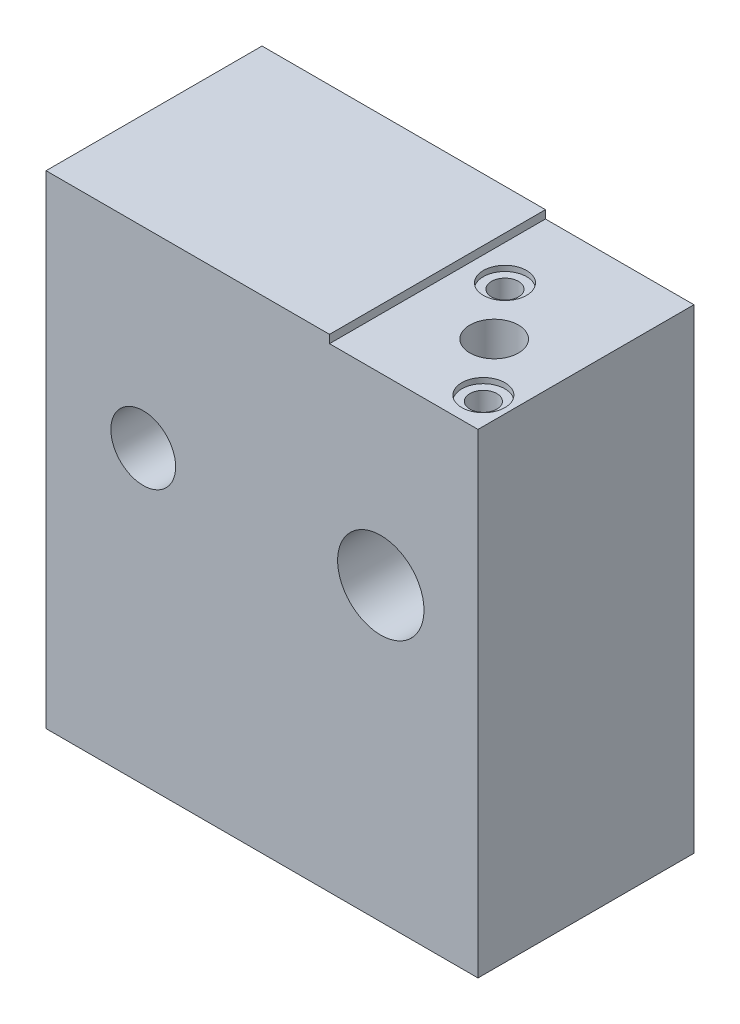
from build123d import *

# Parameters (mm, degrees)
SKETCH_1_W          = 80
SKETCH_1_H          = 40
EXTRUDE_1_DEPTH     = 89.5
SKETCH_2_W          = 27.5
SKETCH_2_H          = 1.5
CUT_EXTRUDE_1_DEPTH = 46
SKETCH_3_R          = 6
SKETCH_3_R_2        = 8
CUT_EXTRUDE_2_DEPTH = 46
SKETCH_4_R          = 2.5
SKETCH_4_R_2        = 4.5
CUT_EXTRUDE_3_DEPTH = 15
SKETCH_5_R          = 4
CUT_EXTRUDE_4_DEPTH = 1


with BuildPart() as part:
    # 草图1 → 凸台-拉伸1 (new body)
    with BuildSketch(Plane(origin=(0, 0, 0), x_dir=(1, 0, 0), z_dir=(0, 1, 0))):
        Rectangle(SKETCH_1_W, SKETCH_1_H)
    extrude(amount=EXTRUDE_1_DEPTH)

    # 草图2 → 切除-拉伸1 (cut)
    with BuildSketch(Plane.XY.offset(20)):
        with Locations((26.25, 88.75)):
            Rectangle(SKETCH_2_W, SKETCH_2_H)
    extrude(amount=-CUT_EXTRUDE_1_DEPTH, mode=Mode.SUBTRACT)

    # 草图3 → 切除-拉伸2 (cut)
    with BuildSketch(Plane.XY.offset(20)):
        with Locations((-22, 54)):
            Circle(SKETCH_3_R)
        with Locations((22, 54)):
            Circle(SKETCH_3_R_2)
    extrude(amount=-CUT_EXTRUDE_2_DEPTH, mode=Mode.SUBTRACT)

    # 草图4 → 切除-拉伸3 (cut)
    with BuildSketch(Plane(origin=(0, 88, 0), x_dir=(1, 0, 0), z_dir=(0, 1, 0))):
        with Locations(Location((35, -14, 0), (0, 0, 270))):
            Circle(SKETCH_4_R)
        with Locations(Location((19, 6, 0), (0, 0, 270))):
            Circle(SKETCH_4_R)
        with Locations(Location((27, -4, 0), (0, 0, 270))):
            Circle(SKETCH_4_R_2)
    extrude(amount=-CUT_EXTRUDE_3_DEPTH, mode=Mode.SUBTRACT)

    # 草图5 → 切除-拉伸4 (cut)
    with BuildSketch(Plane(origin=(0, 88, 0), x_dir=(1, 0, 0), z_dir=(0, 1, 0))):
        with Locations(Location((19, 6, 0), (0, 0, 270))):
            Circle(SKETCH_5_R)
        with Locations(Location((35, -14, 0), (0, 0, 270))):
            Circle(SKETCH_5_R)
    extrude(amount=-CUT_EXTRUDE_4_DEPTH, mode=Mode.SUBTRACT)


solid = part.part
